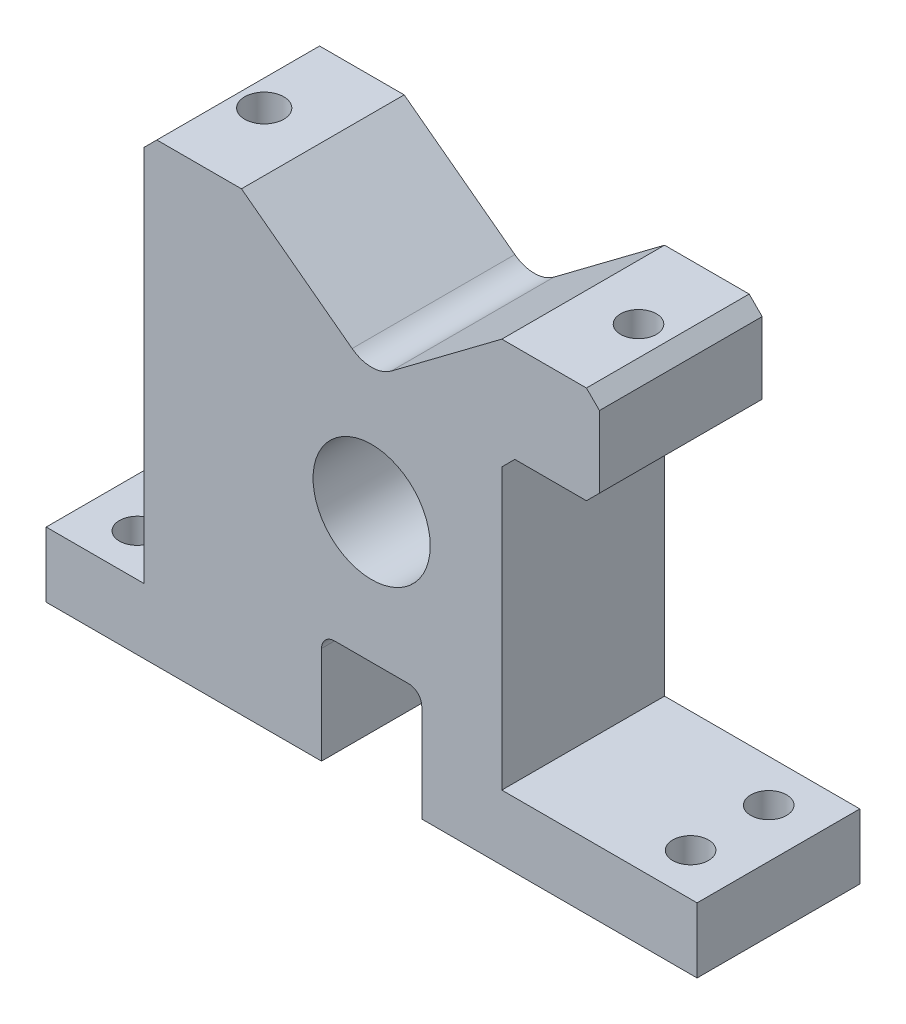
from build123d import *

# Parameters (mm, degrees)
BOSS_EXTRUDE1_DEPTH       = 25
SKETCH2_R                 = 11.2
CUT_EXTRUDE1_DEPTH        = 90.582364336
CHAMFER2_SIZE             = 2
SKETCH11_R                = 11.4
SKETCH11_R_2              = 9
BOSS_EXTRUDE3_DEPTH       = 18
M5_CLEARANCE_HOLE1_D      = 5.5
M5_CLEARANCE_HOLE2_D      = 5.5
M5_CLEARANCE_HOLE2_DEPTH  = 15
F_6_0MM_DOWEL_HOLE1_D     = 6
F_6_0MM_DOWEL_HOLE1_DEPTH = 40
F_6_0MM_DOWEL_HOLE1_TIP   = 1.802581857


with BuildPart() as part:
    # Sketch1 → Boss-Extrude1 (new body)
    with BuildSketch(Plane.XY):
        with BuildLine():
            Line((50, 0), (50, 10))
            Line((50, 10), (35, 10))
            Line((35, 10), (20, 10))
            Line((20, 10), (20, 55))
            Line((20, 55), (35, 55))
            Line((35, 55), (35, 70))
            Line((35, 70), (20, 70))
            Line((20, 70), (3, 57.25))
            ThreePointArc((3, 57.25), (0, 56.25), (-3, 57.25))
            Line((-3, 57.25), (-20, 70))
            Line((-20, 70), (-35, 70))
            Line((-35, 70), (-35, 10))
            Line((-35, 10), (-50, 10))
            Line((-50, 10), (-50, 0))
            Line((-50, 0), (-7.7, 0))
            Line((-7.7, 0), (-7.7, 15))
            ThreePointArc((-7.7, 15), (-7.114213562, 16.414213562), (-5.7, 17))
            Line((-5.7, 17), (5.7, 17))
            ThreePointArc((5.7, 17), (7.114213562, 16.414213562), (7.7, 15))
            Line((7.7, 15), (7.7, 0))
            Line((7.7, 0), (50, 0))
        make_face()
    extrude(amount=BOSS_EXTRUDE1_DEPTH)

    # Sketch2 → Cut-Extrude1 (cut, through all)
    with BuildSketch(Plane(origin=(0, 0, 0), x_dir=(-1, 0, 0), z_dir=(0, 0, -1))):
        with Locations((0, 37)):
            Circle(SKETCH2_R)
    extrude(amount=-CUT_EXTRUDE1_DEPTH, mode=Mode.SUBTRACT)

    # Chamfer2
    chamfer2_edges = [part.edges().sort_by_distance(p)[0] for p in [
        (-35, 70, 12.5),
        (35, 70, 12.5),
        (35, 55, 12.5),
        (20, 55, 12.5),
    ]]
    chamfer(chamfer2_edges, length=CHAMFER2_SIZE)

    # Sketch11 → Boss-Extrude3 (add)
    with BuildSketch(Plane.XY.offset(25)):
        with Locations((0, 37)):
            Circle(SKETCH11_R)
        with Locations((0, 37)):
            Circle(SKETCH11_R_2, mode=Mode.SUBTRACT)
    extrude(amount=-BOSS_EXTRUDE3_DEPTH)

    # M5 Clearance Hole1 (through all)
    with Locations(Plane(origin=(0, 10, 0), x_dir=(1, 0, 0), z_dir=(0, 1, 0))):
        with Locations((42.5, -18.5), (42.5, -6.5), (-42.5, -18.5), (-42.5, -6.5)):
            Hole(M5_CLEARANCE_HOLE1_D / 2)

    # M5 Clearance Hole2
    with Locations(Plane(origin=(0, 70, 0), x_dir=(1, 0, 0), z_dir=(0, 1, 0))):
        with Locations((28.5, -12.5)):
            Hole(M5_CLEARANCE_HOLE2_D / 2, depth=M5_CLEARANCE_HOLE2_DEPTH)

    # Ø6.0mm Dowel Hole1
    with Locations(Plane(origin=(0, 70, 0), x_dir=(1, 0, 0), z_dir=(0, 1, 0))):
        with Locations((-29, -12.5)):
            Hole(F_6_0MM_DOWEL_HOLE1_D / 2, depth=F_6_0MM_DOWEL_HOLE1_DEPTH)
            with Locations((0, 0, -(F_6_0MM_DOWEL_HOLE1_DEPTH + F_6_0MM_DOWEL_HOLE1_TIP / 2))):  # 118° drill point
                Cone(0, F_6_0MM_DOWEL_HOLE1_D / 2, F_6_0MM_DOWEL_HOLE1_TIP, mode=Mode.SUBTRACT)


solid = part.part
